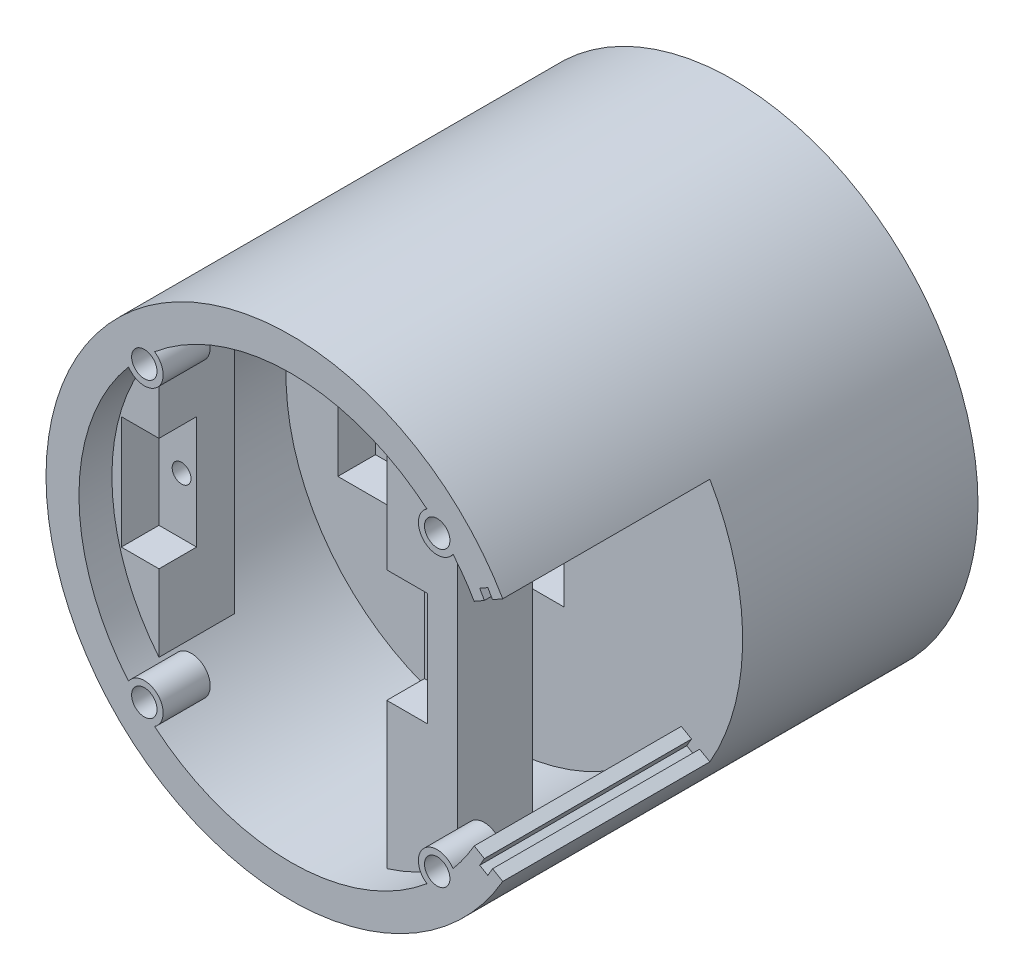
from build123d import *

# Parameters (mm, degrees)
SKETCH_1_R           = 26
EXTRUDE_1_DEPTH      = 47
SKETCH_3_R           = 22.5
CUT_EXTRUDE_1_DEPTH  = 20
CUT_EXTRUDE_START    = -22
SKETCH_4_R           = 22.5
CUT_EXTRUDE_2_DEPTH  = 22
SKETCH_13_W          = 24
SKETCH_13_H          = 13
CUT_EXTRUDE_3_DEPTH  = 4
CUT_EXTRUDE_4_DEPTH  = 22
EXTRUDE_2_DEPTH      = 8
SKETCH_15_W          = 4
SKETCH_15_H          = 12
SKETCH_15_W_2        = 4.3
CUT_EXTRUDE_5_DEPTH  = 4
SKETCH_17_R          = 1
CUT_EXTRUDE_6_DEPTH  = 4
CHAMFER_1_SIZE       = 1
SKETCH_20_R          = 2
EXTRUDE_3_DEPTH      = 5
SKETCH_21_R          = 1.35
CUT_EXTRUDE_9_DEPTH  = 5
SKETCH_22_W          = 1
SKETCH_22_H          = 22
CUT_EXTRUDE_10_DEPTH = 1
SKETCH_23_W          = 1
SKETCH_23_H          = 22
CUT_EXTRUDE_11_DEPTH = 1


with BuildPart() as part:
    # Эскиз1 → Бобышка-Вытянуть1 (new body)
    with BuildSketch(Plane.XY):
        Circle(SKETCH_1_R)
    extrude(amount=EXTRUDE_1_DEPTH)

    # Эскиз3 → Вырез-Вытянуть1 (cut)
    with BuildSketch(Plane(origin=(0, 0, 0), x_dir=(-1, 0, 0), z_dir=(0, 0, -1))):
        Circle(SKETCH_3_R)
    extrude(amount=-CUT_EXTRUDE_1_DEPTH, mode=Mode.SUBTRACT)

    # Эскиз4 → Вырез-Вытянуть2 (cut)
    with BuildSketch(Plane.XY.offset(47).offset(CUT_EXTRUDE_START)):
        with Locations(Location((0, 0, 0), (0, 0, 180))):
            Circle(SKETCH_4_R)
    extrude(amount=CUT_EXTRUDE_2_DEPTH, mode=Mode.SUBTRACT)

    # Эскиз13 → Вырез-Вытянуть3 (cut)
    with BuildSketch(Plane.XY.offset(25)):
        with Locations((-5, 0)):
            Rectangle(SKETCH_13_W, SKETCH_13_H)
    extrude(amount=-CUT_EXTRUDE_3_DEPTH, mode=Mode.SUBTRACT)

    # Эскиз12 → Вырез-Вытянуть4 (cut)
    with BuildSketch(Plane.XY.offset(47).offset(CUT_EXTRUDE_START)):
        with BuildLine():
            Line((19.485571585, 11.25), (22.516660498, 13))
            ThreePointArc((22.516660498, 13), (26, 0), (22.516660498, -13))
            Line((22.516660498, -13), (19.485571585, -11.25))
            ThreePointArc((19.485571585, -11.25), (22.5, 0), (19.485571585, 11.25))
        make_face()
    extrude(amount=CUT_EXTRUDE_4_DEPTH, mode=Mode.SUBTRACT)

    # Эскиз14 → Бобышка-Вытянуть2 (add)
    with BuildSketch(Plane.XY.offset(35.5)):
        with BuildLine():
            Line((14.2, -20.575713839), (14.2, 20.575713839))
            ThreePointArc((14.2, 20.575713839), (10.596324929, 22.643274896), (6.7, 24.0854728))
            Line((6.7, 24.0854728), (6.7, -24.0854728))
            ThreePointArc((6.7, -24.0854728), (10.596324929, -22.643274896), (14.2, -20.575713839))
        make_face()
        with BuildLine():
            Line((-17.5, -17.853571071), (-17.5, 17.853571071))
            ThreePointArc((-17.5, 17.853571071), (-25, 0), (-17.5, -17.853571071))
        make_face()
    extrude(amount=EXTRUDE_2_DEPTH)

    # Эскиз15 → Вырез-Вытянуть5 (cut)
    with BuildSketch(Plane.XY.offset(43.5)):
        with Locations((-19.5, 0)):
            Rectangle(SKETCH_15_W, SKETCH_15_H)
        with Locations((8.85, 0)):
            Rectangle(SKETCH_15_W_2, SKETCH_15_H)
    extrude(amount=-CUT_EXTRUDE_5_DEPTH, mode=Mode.SUBTRACT)

    # Эскиз17 → Вырез-Вытянуть6 (cut)
    with BuildSketch(Plane.XY.offset(39.5)):
        with Locations((-19.1, 0)):
            Circle(SKETCH_17_R)
        with Locations((8.6, 0)):
            Circle(SKETCH_17_R)
    extrude(amount=-CUT_EXTRUDE_6_DEPTH, mode=Mode.SUBTRACT)

    # Фаска1
    chamfer_1_edges = [part.edges().sort_by_distance(p)[0] for p in [
        (22.5, 0, 0),
    ]]
    chamfer(chamfer_1_edges, length=CHAMFER_1_SIZE)

    # Эскиз20 → Бобышка-Вытянуть3 (add)
    with BuildSketch(Plane.XY.offset(47)):
        with Locations((-15.556349186, 15.556349186)):
            Circle(SKETCH_20_R)
        with Locations((15.556349186, 15.556349186)):
            Circle(SKETCH_20_R)
        with Locations((15.556349186, -15.556349186)):
            Circle(SKETCH_20_R)
        with Locations((-15.556349186, -15.556349186)):
            Circle(SKETCH_20_R)
    extrude(amount=-EXTRUDE_3_DEPTH)

    # Эскиз21 → Вырез-Вытянуть9 (cut)
    with BuildSketch(Plane.XY.offset(47)):
        with Locations((-15.556349186, 15.556349186)):
            Circle(SKETCH_21_R)
        with Locations((15.556349186, 15.556349186)):
            Circle(SKETCH_21_R)
        with Locations((15.556349186, -15.556349186)):
            Circle(SKETCH_21_R)
        with Locations((-15.556349186, -15.556349186)):
            Circle(SKETCH_21_R)
    extrude(amount=-CUT_EXTRUDE_9_DEPTH, mode=Mode.SUBTRACT)

    # Эскиз22 → Вырез-Вытянуть10 (cut)
    with BuildSketch(Plane(origin=(0, 0, 0), x_dir=(0.8660254037844378, 0.5000000000000016, 0), z_dir=(0.5000000000000014, -0.8660254037844377, 0))):
        with Locations((24.25, 36)):
            Rectangle(SKETCH_22_W, SKETCH_22_H)
    extrude(amount=-CUT_EXTRUDE_10_DEPTH, mode=Mode.SUBTRACT)

    # Эскиз23 → Вырез-Вытянуть11 (cut)
    with BuildSketch(Plane(origin=(0, 0, 0), x_dir=(0.8660254037844378, -0.5000000000000016, 0), z_dir=(0.5000000000000014, 0.8660254037844377, 0))):
        with Locations((24.25, -36)):
            Rectangle(SKETCH_23_W, SKETCH_23_H)
    extrude(amount=-CUT_EXTRUDE_11_DEPTH, mode=Mode.SUBTRACT)


solid = part.part
